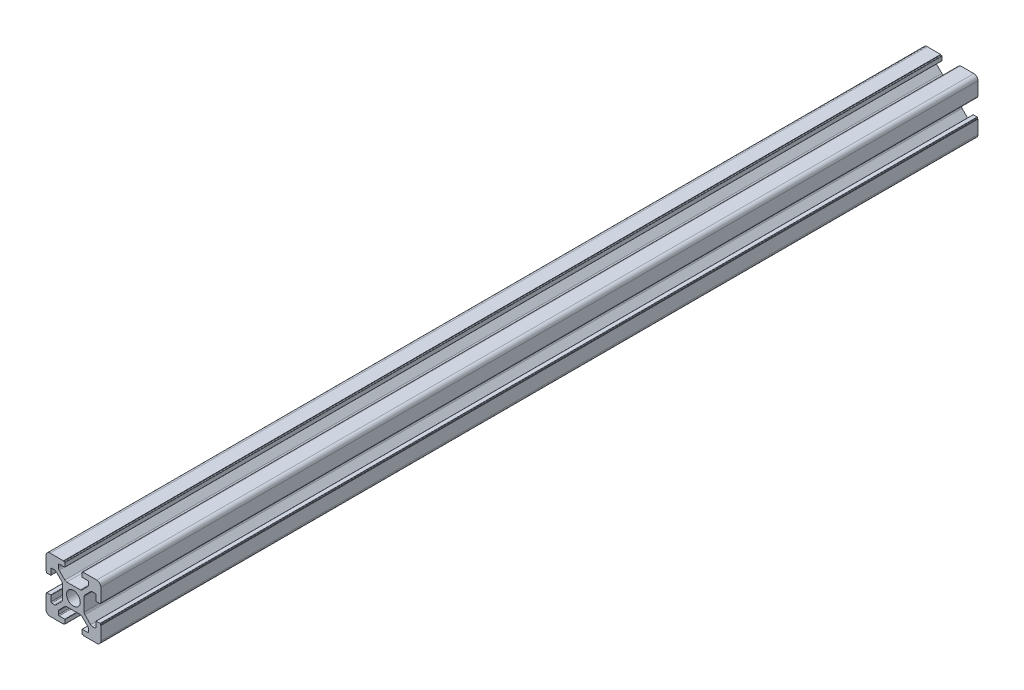
from build123d import *

# Parameters (mm, degrees)
SKETCH_1_R      = 2.5
EXTRUDE_1_DEPTH = 320
FILLET_1_R      = 1.5


with BuildPart() as part:
    # 草图1 → 凸台-拉伸1 (new body)
    with BuildSketch(Plane.XY):
        with BuildLine():
            Line((20, 13.6), (20, 20))
            Line((20, 20), (13.6, 20))
            Line((13.6, 20), (13.6, 19.8))
            Line((13.6, 19.8), (13.2, 19.8))
            ThreePointArc((13.2, 19.8), (13.129289322, 19.770710678), (13.1, 19.7))
            Line((13.1, 19.7), (13.1, 18.3))
            ThreePointArc((13.1, 18.3), (13.129289322, 18.229289322), (13.2, 18.2))
            Line((13.2, 18.2), (15.2, 18.2))
            ThreePointArc((15.2, 18.2), (15.412132034, 18.112132034), (15.5, 17.9))
            Line((15.5, 17.9), (15.5, 16.974873734))
            ThreePointArc((15.5, 16.974873734), (15.423879533, 16.592190302), (15.207106781, 16.267766953))
            Line((15.207106781, 16.267766953), (13.132233047, 14.192893219))
            ThreePointArc((13.132233047, 14.192893219), (12.807809698, 13.976120467), (12.425126266, 13.9))
            Line((12.425126266, 13.9), (7.574873734, 13.9))
            ThreePointArc((7.574873734, 13.9), (7.192190302, 13.976120467), (6.867766953, 14.192893219))
            Line((6.867766953, 14.192893219), (4.792893219, 16.267766953))
            ThreePointArc((4.792893219, 16.267766953), (4.576120467, 16.592190302), (4.5, 16.974873734))
            Line((4.5, 16.974873734), (4.5, 17.9))
            ThreePointArc((4.5, 17.9), (4.587867966, 18.112132034), (4.8, 18.2))
            Line((4.8, 18.2), (6.8, 18.2))
            ThreePointArc((6.8, 18.2), (6.870710678, 18.229289322), (6.9, 18.3))
            Line((6.9, 18.3), (6.9, 19.7))
            ThreePointArc((6.9, 19.7), (6.870710678, 19.770710678), (6.8, 19.8))
            Line((6.8, 19.8), (6.4, 19.8))
            Line((6.4, 19.8), (6.4, 20))
            Line((6.4, 20), (0, 20))
            Line((0, 20), (0, 13.6))
            Line((0, 13.6), (0.2, 13.6))
            Line((0.2, 13.6), (0.2, 13.2))
            ThreePointArc((0.2, 13.2), (0.229289322, 13.129289322), (0.3, 13.1))
            Line((0.3, 13.1), (1.7, 13.1))
            ThreePointArc((1.7, 13.1), (1.770710678, 13.129289322), (1.8, 13.2))
            Line((1.8, 13.2), (1.8, 15.2))
            ThreePointArc((1.8, 15.2), (1.887867966, 15.412132034), (2.1, 15.5))
            Line((2.1, 15.5), (3.025126266, 15.5))
            ThreePointArc((3.025126266, 15.5), (3.407809698, 15.423879533), (3.732233047, 15.207106781))
            Line((3.732233047, 15.207106781), (5.807106781, 13.132233047))
            ThreePointArc((5.807106781, 13.132233047), (6.023879533, 12.807809698), (6.1, 12.425126266))
            Line((6.1, 12.425126266), (6.1, 7.574873734))
            ThreePointArc((6.1, 7.574873734), (6.023879533, 7.192190302), (5.807106781, 6.867766953))
            Line((5.807106781, 6.867766953), (3.732233047, 4.792893219))
            ThreePointArc((3.732233047, 4.792893219), (3.407809698, 4.576120467), (3.025126266, 4.5))
            Line((3.025126266, 4.5), (2.1, 4.5))
            ThreePointArc((2.1, 4.5), (1.887867966, 4.587867966), (1.8, 4.8))
            Line((1.8, 4.8), (1.8, 6.8))
            ThreePointArc((1.8, 6.8), (1.770710678, 6.870710678), (1.7, 6.9))
            Line((1.7, 6.9), (0.3, 6.9))
            ThreePointArc((0.3, 6.9), (0.229289322, 6.870710678), (0.2, 6.8))
            Line((0.2, 6.8), (0.2, 6.4))
            Line((0.2, 6.4), (0, 6.4))
            Line((0, 6.4), (0, 0))
            Line((0, 0), (6.4, 0))
            Line((6.4, 0), (6.4, 0.2))
            Line((6.4, 0.2), (6.8, 0.2))
            ThreePointArc((6.8, 0.2), (6.870710678, 0.229289322), (6.9, 0.3))
            Line((6.9, 0.3), (6.9, 1.7))
            ThreePointArc((6.9, 1.7), (6.870710678, 1.770710678), (6.8, 1.8))
            Line((6.8, 1.8), (4.8, 1.8))
            ThreePointArc((4.8, 1.8), (4.587867966, 1.887867966), (4.5, 2.1))
            Line((4.5, 2.1), (4.5, 3.025126266))
            ThreePointArc((4.5, 3.025126266), (4.576120467, 3.407809698), (4.792893219, 3.732233047))
            Line((4.792893219, 3.732233047), (6.867766953, 5.807106781))
            ThreePointArc((6.867766953, 5.807106781), (7.192190302, 6.023879533), (7.574873734, 6.1))
            Line((7.574873734, 6.1), (12.425126266, 6.1))
            ThreePointArc((12.425126266, 6.1), (12.807809698, 6.023879533), (13.132233047, 5.807106781))
            Line((13.132233047, 5.807106781), (15.207106781, 3.732233047))
            ThreePointArc((15.207106781, 3.732233047), (15.423879533, 3.407809698), (15.5, 3.025126266))
            Line((15.5, 3.025126266), (15.5, 2.1))
            ThreePointArc((15.5, 2.1), (15.412132034, 1.887867966), (15.2, 1.8))
            Line((15.2, 1.8), (13.2, 1.8))
            ThreePointArc((13.2, 1.8), (13.129289322, 1.770710678), (13.1, 1.7))
            Line((13.1, 1.7), (13.1, 0.3))
            ThreePointArc((13.1, 0.3), (13.129289322, 0.229289322), (13.2, 0.2))
            Line((13.2, 0.2), (13.6, 0.2))
            Line((13.6, 0.2), (13.6, 0))
            Line((13.6, 0), (20, 0))
            Line((20, 0), (20, 6.4))
            Line((20, 6.4), (19.8, 6.4))
            Line((19.8, 6.4), (19.8, 6.8))
            ThreePointArc((19.8, 6.8), (19.770710678, 6.870710678), (19.7, 6.9))
            Line((19.7, 6.9), (18.3, 6.9))
            ThreePointArc((18.3, 6.9), (18.229289322, 6.870710678), (18.2, 6.8))
            Line((18.2, 6.8), (18.2, 4.8))
            ThreePointArc((18.2, 4.8), (18.112132034, 4.587867966), (17.9, 4.5))
            Line((17.9, 4.5), (16.974873734, 4.5))
            ThreePointArc((16.974873734, 4.5), (16.592190302, 4.576120467), (16.267766953, 4.792893219))
            Line((16.267766953, 4.792893219), (14.192893219, 6.867766953))
            ThreePointArc((14.192893219, 6.867766953), (13.976120467, 7.192190302), (13.9, 7.574873734))
            Line((13.9, 7.574873734), (13.9, 12.425126266))
            ThreePointArc((13.9, 12.425126266), (13.976120467, 12.807809698), (14.192893219, 13.132233047))
            Line((14.192893219, 13.132233047), (16.267766953, 15.207106781))
            ThreePointArc((16.267766953, 15.207106781), (16.592190302, 15.423879533), (16.974873734, 15.5))
            Line((16.974873734, 15.5), (17.9, 15.5))
            ThreePointArc((17.9, 15.5), (18.112132034, 15.412132034), (18.2, 15.2))
            Line((18.2, 15.2), (18.2, 13.2))
            ThreePointArc((18.2, 13.2), (18.229289322, 13.129289322), (18.3, 13.1))
            Line((18.3, 13.1), (19.7, 13.1))
            ThreePointArc((19.7, 13.1), (19.770710678, 13.129289322), (19.8, 13.2))
            Line((19.8, 13.2), (19.8, 13.6))
            Line((19.8, 13.6), (20, 13.6))
        make_face()
        with Locations((10, 10)):
            Circle(SKETCH_1_R, mode=Mode.SUBTRACT)
    extrude(amount=EXTRUDE_1_DEPTH)

    # 圆角1
    fillet_1_edges = [part.edges().sort_by_distance(p)[0] for p in [
        (0, 0, 160),
        (0, 20, 160),
        (20, 20, 160),
        (20, 0, 160),
    ]]
    fillet(fillet_1_edges, radius=FILLET_1_R)


solid = part.part
